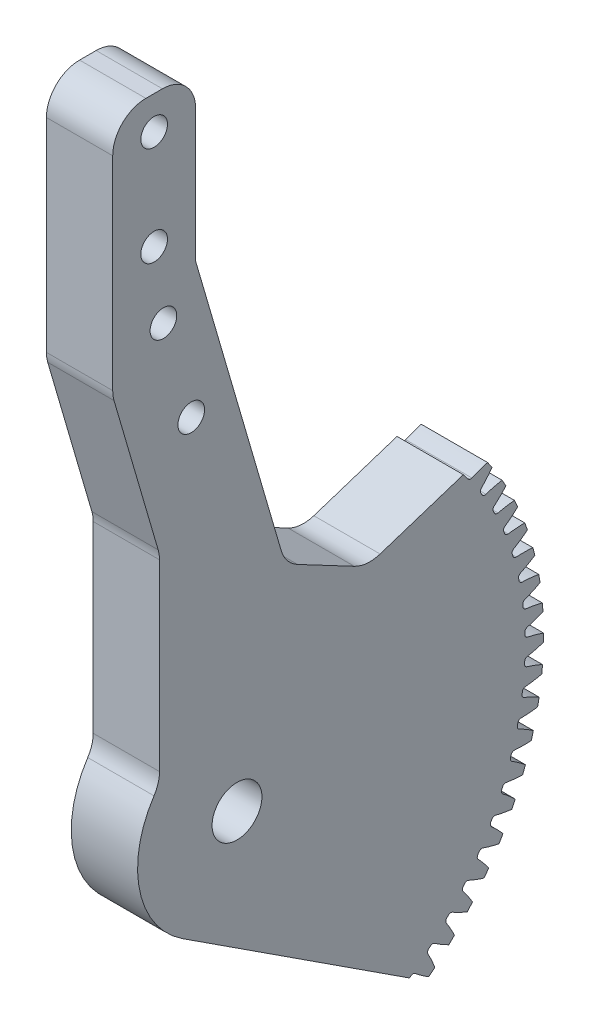
from build123d import *

# Parameters (mm, degrees)
SKETCH1_R              = 4.7752
BOSS_EXTRUDE1_DEPTH    = 12.7
BOSS_EXTRUDE2_DEPTH    = 12.7
CUT_EXTRUDE1_DEPTH     = 142.171511379
F_10_CLEARANCE_HOLE1_D = 5.1054


with BuildPart() as part:
    # Sketch1 → Boss-Extrude1 (new body)
    with BuildSketch(Plane(origin=(-6.35, 0, 0), x_dir=(0, -1, 0), z_dir=(-1, 0, 0))):
        with BuildLine():
            Line((-81.679142857, 23.8125), (-120.65, 23.8125))
            ThreePointArc((-120.65, 23.8125), (-125.140128061, 21.952628061), (-127, 17.4625))
            Line((-127, 17.4625), (-127, 14.2875))
            ThreePointArc((-127, 14.2875), (-125.140128061, 9.797371939), (-120.65, 7.9375))
            Line((-120.65, 7.9375), (-95.25, 7.9375))
            Line((-95.25, 7.9375), (-38.967735987, -8.478160337))
            ThreePointArc((-38.967735987, -8.478160337), (-36.732148227, -9.653427334), (-35.131518575, -11.607164744))
            Line((-35.131518575, -11.607164744), (-29.381861992, -22.486797386))
            ThreePointArc((-29.381861992, -22.486797386), (-28.66941346, -24.909919801), (-28.957856919, -27.419084108))
            Line((-28.957856919, -27.419084108), (-34.080768064, -43.158877976))
            ThreePointArc((-34.080768064, -43.158877976), (-34.074007353, -45.144703123), (-32.888813105, -46.738083749))
            ThreePointArc((-32.888813105, -46.738083749), (7.459571885, -56.661073828), (43.86486018, -36.633270962))
            ThreePointArc((43.86486018, -36.633270962), (44.597272662, -34.787432621), (44.089833638, -32.867523024))
            Line((44.089833638, -32.867523024), (15.971460809, 10.383397306))
            ThreePointArc((15.971460809, 10.383397306), (3.88595663, 18.649446133), (-10.495201299, 15.898215299))
            ThreePointArc((-10.495201299, 15.898215299), (-12.167228602, 15.115937968), (-13.993601732, 14.847620399))
            Line((-13.993601732, 14.847620399), (-49.128127081, 14.847620399))
            ThreePointArc((-49.128127081, 14.847620399), (-50.026152693, 14.911441114), (-50.906127081, 15.101620399))
            Line((-50.906127081, 15.101620399), (-79.901142857, 23.5585))
            ThreePointArc((-79.901142857, 23.5585), (-80.781117245, 23.748679285), (-81.679142857, 23.8125))
        make_face()
        with Locations(Location((0, 0, 0), (0, 0, 270))):
            Circle(SKETCH1_R, mode=Mode.SUBTRACT)
    extrude(amount=-BOSS_EXTRUDE1_DEPTH)

    # Sketch4 → Boss-Extrude2 (add)
    with BuildSketch(Plane.ZY.offset(6.35)):
        with BuildLine():
            Line((-43.158877976, 34.080768064), (-48.531928568, 35.829562298))
            ThreePointArc((-48.531928568, 35.829562298), (-59.808911262, -7.873992546), (-37.604870103, -47.169686977))
            Line((-37.604870103, -47.169686977), (-32.867523024, -44.089833638))
            ThreePointArc((-32.867523024, -44.089833638), (-34.787432621, -44.597272662), (-36.633270962, -43.86486018))
            ThreePointArc((-36.633270962, -43.86486018), (-56.661073828, -7.459571885), (-46.738083749, 32.888813105))
            ThreePointArc((-46.738083749, 32.888813105), (-45.144703123, 34.074007353), (-43.158877976, 34.080768064))
        make_face()
    extrude(amount=-BOSS_EXTRUDE2_DEPTH)

    # Sketch3 → Cut-Extrude1 (cut, through all)
    with BuildSketch(Plane.ZY.offset(6.35)):
        with BuildLine():
            Line((-43.363168473, 34.147259536), (-48.531928568, 35.829562298))
            ThreePointArc((-48.531928568, 35.829562298), (-59.808911262, -7.873992546), (-37.604870103, -47.169686977))
            Line((-37.604870103, -47.169686977), (-33.047643231, -44.20693374))
            ThreePointArc((-33.047643231, -44.20693374), (-33.203190466, -44.090224049), (-33.358325537, -43.97296705))
            ThreePointArc((-33.358325537, -43.97296705), (-33.748230936, -43.846260006), (-34.132591878, -43.988904884))
            ThreePointArc((-34.132591878, -43.988904884), (-35.396795898, -44.959962193), (-36.726096713, -45.839805046))
            ThreePointArc((-36.726096713, -45.839805046), (-37.314607361, -45.362032405), (-37.896903279, -44.876704739))
            ThreePointArc((-37.896903279, -44.876704739), (-37.289925073, -43.402682499), (-36.580890975, -41.974944864))
            ThreePointArc((-36.580890975, -41.974944864), (-36.515045821, -41.570290307), (-36.714565857, -41.212138593))
            ThreePointArc((-36.714565857, -41.212138593), (-36.889558568, -41.055574312), (-37.063883639, -40.898266993))
            ThreePointArc((-37.063883639, -40.898266993), (-37.441262084, -40.738059613), (-37.836592737, -40.846662421))
            ThreePointArc((-37.836592737, -40.846662421), (-39.1806193, -41.703841923), (-40.581545081, -42.464480508))
            ThreePointArc((-40.581545081, -42.464480508), (-41.126175639, -41.937233854), (-41.663956653, -41.403002573))
            ThreePointArc((-41.663956653, -41.403002573), (-40.93081868, -39.987491071), (-40.100047137, -38.626982803))
            ThreePointArc((-40.100047137, -38.626982803), (-39.999184576, -38.229606862), (-40.166730399, -37.855428706))
            ThreePointArc((-40.166730399, -37.855428706), (-40.327411734, -37.68420858), (-40.487363209, -37.512306432))
            ThreePointArc((-40.487363209, -37.512306432), (-40.849342622, -37.319817991), (-41.252634281, -37.393552195))
            ThreePointArc((-41.252634281, -37.393552195), (-42.666254533, -38.130330238), (-44.12814339, -38.765975637))
            ThreePointArc((-44.12814339, -38.765975637), (-44.62474889, -38.193267634), (-45.113922161, -37.614198561))
            ThreePointArc((-45.113922161, -37.614198561), (-44.260204043, -36.267970692), (-43.314017729, -34.98504608))
            ThreePointArc((-43.314017729, -34.98504608), (-43.178905384, -34.597973026), (-43.31320187, -34.21061615))
            ThreePointArc((-43.31320187, -34.21061615), (-43.458348946, -34.026043268), (-43.602709498, -33.84085457))
            ThreePointArc((-43.602709498, -33.84085457), (-43.946534997, -33.617550021), (-44.354718368, -33.655854461))
            ThreePointArc((-44.354718368, -33.655854461), (-45.827173807, -34.266623716), (-47.338899882, -34.772438283))
            ThreePointArc((-47.338899882, -34.772438283), (-47.783700858, -34.158627585), (-48.220543481, -33.539127785))
            ThreePointArc((-48.220543481, -33.539127785), (-47.252742528, -32.272429155), (-46.198342491, -31.07685203))
            ThreePointArc((-46.198342491, -31.07685203), (-46.03000865, -30.703027722), (-46.130033721, -30.305440146))
            ThreePointArc((-46.130033721, -30.305440146), (-46.258541882, -30.108919218), (-46.38621284, -29.911853368))
            ThreePointArc((-46.38621284, -29.911853368), (-46.709267705, -29.659432194), (-47.119236268, -29.662015348))
            ThreePointArc((-47.119236268, -29.662015348), (-48.639320617, -30.142127496), (-50.189378762, -30.514261677))
            ThreePointArc((-50.189378762, -30.514261677), (-50.578990008, -29.864019756), (-50.960177347, -29.208803997))
            ThreePointArc((-50.960177347, -29.208803997), (-49.88565911, -28.03127495), (-48.731069971, -26.932144375))
            ThreePointArc((-48.731069971, -26.932144375), (-48.530795756, -26.574413843), (-48.595788161, -26.169621448))
            ThreePointArc((-48.595788161, -26.169621448), (-48.706679383, -25.962648117), (-48.816689094, -25.755204904))
            ThreePointArc((-48.816689094, -25.755204904), (-49.116514683, -25.475588181), (-49.525148328, -25.442430392))
            ThreePointArc((-49.525148328, -25.442430392), (-51.081292828, -25.788231487), (-52.657886165, -26.023853115))
            ThreePointArc((-52.657886165, -26.023853115), (-52.989342505, -25.342128704), (-53.311973495, -24.656183573))
            ThreePointArc((-53.311973495, -24.656183573), (-52.138915704, -23.576785813), (-50.892924583, -22.582466835))
            ThreePointArc((-50.892924583, -22.582466835), (-50.662234201, -22.243552623), (-50.691699309, -21.834636125))
            ThreePointArc((-50.691699309, -21.834636125), (-50.784129641, -21.618785582), (-50.875640865, -21.402543775))
            ThreePointArc((-50.875640865, -21.402543775), (-51.149955324, -21.097859557), (-51.554144103, -21.029213174))
            ThreePointArc((-51.554144103, -21.029213174), (-53.134505555, -21.238071462), (-54.725635256, -21.335387317))
            ThreePointArc((-54.725635256, -21.335387317), (-54.996414107, -20.627368749), (-55.258033332, -19.915914702))
            ThreePointArc((-55.258033332, -19.915914702), (-53.995363668, -18.942863101), (-52.667453311, -18.060923089))
            ThreePointArc((-52.667453311, -18.060923089), (-52.408102456, -17.743404539), (-52.401816019, -17.333476038))
            ThreePointArc((-52.401816019, -17.333476038), (-52.475082012, -17.110391038), (-52.547398293, -16.886996368))
            ThreePointArc((-52.547398293, -16.886996368), (-52.794113923, -16.559563484), (-53.190781715, -16.455950948))
            ThreePointArc((-53.190781715, -16.455950948), (-54.783332613, -16.526276891), (-56.376889221, -16.484546339))
            ThreePointArc((-56.376889221, -16.484546339), (-56.584929793, -15.755622063), (-56.783546172, -15.024073695))
            ThreePointArc((-56.783546172, -15.024073695), (-55.440874312, -14.164773762), (-54.041150918, -13.401924811))
            ThreePointArc((-54.041150918, -13.401924811), (-53.755113406, -13.108218432), (-53.713123268, -12.700397732))
            ThreePointArc((-53.713123268, -12.700397732), (-53.766667323, -12.471776085), (-53.81923829, -12.24292872))
            ThreePointArc((-53.81923829, -12.24292872), (-54.036477437, -11.895239134), (-54.422605361, -11.757448999))
            ThreePointArc((-54.422605361, -11.757448999), (-56.015225432, -11.688707374), (-57.599081018, -11.50824801))
            ThreePointArc((-57.599081018, -11.50824801), (-57.742799996, -10.763965581), (-57.876901938, -10.017890418))
            ThreePointArc((-57.876901938, -10.017890418), (-56.464446426, -9.278881944), (-55.003562735, -8.640929796))
            ThreePointArc((-55.003562735, -8.640929796), (-54.693015485, -8.37327087), (-54.615641215, -7.970661732))
            ThreePointArc((-54.615641215, -7.970661732), (-54.64905583, -7.738243387), (-54.681481386, -7.505684993))
            ThreePointArc((-54.681481386, -7.505684993), (-54.867590728, -7.140384831), (-55.240240118, -6.969465763))
            ThreePointArc((-55.240240118, -6.969465763), (-56.820808561, -6.762179736), (-58.382909029, -6.444364964))
            ThreePointArc((-58.382909029, -6.444364964), (-58.461212625, -5.69038882), (-58.529779534, -4.935464944))
            ThreePointArc((-58.529779534, -4.935464944), (-57.058290007, -4.322372228), (-55.547364226, -3.814172084))
            ThreePointArc((-55.547364226, -3.814172084), (-55.214670689, -3.574597657), (-55.102501154, -3.180264181))
            ThreePointArc((-55.102501154, -3.180264181), (-55.115532022, -2.945817983), (-55.12756539, -2.711318471))
            ThreePointArc((-55.12756539, -2.711318471), (-55.281128523, -2.331187889), (-55.63746329, -2.128440685))
            ThreePointArc((-55.63746329, -2.128440685), (-57.193951026, -1.784187827), (-58.722407847, -1.331436409))
            ThreePointArc((-58.722407847, -1.331436409), (-58.734700123, -0.573504764), (-58.737210163, 0.184522399))
            ThreePointArc((-58.737210163, 0.184522399), (-57.217885549, 0.667033348), (-55.668416736, 1.041613779))
            ThreePointArc((-55.668416736, 1.041613779), (-55.316108912, 1.2512804), (-55.169997789, 1.6343371))
            ThreePointArc((-55.169997789, 1.6343371), (-55.162545738, 1.869026874), (-55.154095336, 2.103682822))
            ThreePointArc((-55.154095336, 2.103682822), (-55.273943551, 2.495750801), (-55.611251774, 2.728783112))
            ThreePointArc((-55.611251774, 2.728783112), (-57.131812991, 3.207382828), (-58.614993686, 3.79162518))
            ThreePointArc((-58.614993686, 3.79162518), (-58.561181091, 4.54774401), (-58.497615159, 5.303105415))
            ThreePointArc((-58.497615159, 5.303105415), (-56.942018433, 5.651362399), (-55.365798982, 5.889472333))
            ThreePointArc((-55.365798982, 5.889472333), (-54.996558145, 6.06763546), (-54.817617427, 6.436500089))
            ThreePointArc((-54.817617427, 6.436500089), (-54.789739172, 6.669647308), (-54.760869313, 6.902673818))
            ThreePointArc((-54.760869313, 6.902673818), (-54.846090494, 7.30369532), (-55.161805053, 7.565239222))
            ThreePointArc((-55.161805053, 7.565239222), (-56.634867362, 8.174543364), (-58.061484031, 8.885830213))
            ThreePointArc((-58.061484031, 8.885830213), (-57.941976111, 9.634381704), (-57.812817983, 10.381328594))
            ThreePointArc((-57.812817983, 10.381328594), (-56.232788175, 10.592681168), (-54.641814065, 10.692508444))
            ThreePointArc((-54.641814065, 10.692508444), (-54.258450361, 10.837812147), (-54.048041897, 11.189677424))
            ThreePointArc((-54.048041897, 11.189677424), (-53.999949608, 11.419507698), (-53.950880009, 11.649131298))
            ThreePointArc((-53.950880009, 11.649131298), (-54.00082557, 12.056054308), (-54.292543687, 12.344119293))
            ThreePointArc((-54.292543687, 12.344119293), (-55.706896194, 13.079490689), (-57.066091422, 13.912408712))
            ThreePointArc((-57.066091422, 13.912408712), (-56.881797704, 14.647695938), (-56.68803035, 15.380543597))
            ThreePointArc((-56.68803035, 15.380543597), (-55.095592443, 15.453383239), (-53.501971951, 15.414168113))
            ThreePointArc((-53.501971951, 15.414168113), (-53.10740301, 15.525506543), (-52.867128133, 15.85769456))
            ThreePointArc((-52.867128133, 15.85769456), (-52.799187822, 16.082458741), (-52.730291932, 16.306931856))
            ThreePointArc((-52.730291932, 16.306931856), (-52.744581758, 16.716659444), (-53.010083282, 17.029053164))
            ThreePointArc((-53.010083282, 17.029053164), (-54.35496191, 17.884895192), (-55.636391402, 18.83310538))
            ThreePointArc((-55.636391402, 18.83310538), (-55.388714473, 19.54953236), (-55.131812581, 20.262703374))
            ThreePointArc((-55.131812581, 20.262703374), (-53.539085987, 20.196475731), (-51.954947524, 20.018516652))
            ThreePointArc((-51.954947524, 20.018516652), (-51.552176254, 20.095042456), (-51.283863602, 20.405025062))
            ThreePointArc((-51.283863602, 20.405025062), (-51.196592335, 20.62301256), (-51.108394494, 20.840626815))
            ThreePointArc((-51.108394494, 20.840626815), (-51.086919831, 21.250040706), (-51.324184134, 21.584385655))
            ThreePointArc((-51.324184134, 21.584385655), (-52.589353545, 22.554184843), (-53.783264847, 23.610470744))
            ThreePointArc((-53.783264847, 23.610470744), (-53.474089678, 24.302585036), (-53.156008426, 24.990651744))
            ThreePointArc((-53.156008426, 24.990651744), (-51.575114756, 24.785860848), (-50.012514574, 24.470512192))
            ThreePointArc((-50.012514574, 24.470512192), (-49.604606306, 24.511642963), (-49.310297901, 24.797061004))
            ThreePointArc((-49.310297901, 24.797061004), (-49.204359865, 25.0066128), (-49.097531312, 25.215712018))
            ThreePointArc((-49.097531312, 25.215712018), (-49.040455595, 25.621696326), (-49.247676953, 25.975447938))
            ThreePointArc((-49.247676953, 25.975447938), (-50.423508444, 27.051823528), (-51.520815171, 28.208146169))
            ThreePointArc((-51.520815171, 28.208146169), (-51.152494771, 28.870680366), (-50.775654949, 29.528406166))
            ThreePointArc((-50.775654949, 29.528406166), (-49.218625761, 29.186610599), (-47.689456191, 28.736272361))
            ThreePointArc((-47.689456191, 28.736272361), (-47.279515354, 28.741695069), (-46.96145106, 29.00037634))
            ThreePointArc((-46.96145106, 29.00037634), (-46.837652508, 29.199897621), (-46.713006272, 29.398890431))
            ThreePointArc((-46.713006272, 29.398890431), (-46.620763881, 29.798355369), (-46.796365216, 30.168821382))
            ThreePointArc((-46.796365216, 30.168821382), (-47.873909999, 31.343581503), (-48.866260983, 32.59114057))
            ThreePointArc((-48.866260983, 32.59114057), (-48.441598495, 33.219052386), (-48.008868081, 33.841431585))
            ThreePointArc((-48.008868081, 33.841431585), (-46.487553307, 33.365232618), (-45.003452254, 32.783332144))
            ThreePointArc((-45.003452254, 32.783332144), (-44.594598746, 32.753005519), (-44.255199224, 32.9829813))
            ThreePointArc((-44.255199224, 32.9829813), (-43.813051428, 33.568083627), (-43.363168473, 34.147259536))
        make_face()
    extrude(amount=-CUT_EXTRUDE1_DEPTH, mode=Mode.SUBTRACT)

    # #10 Clearance Hole1 (through all)
    with Locations(Plane.ZY.offset(6.35)):
        with Locations((15.875, 120.65), (15.875, 101.6), (14.097, 88.020071429), (8.763, 69.732071429)):
            Hole(F_10_CLEARANCE_HOLE1_D / 2)


solid = part.part
